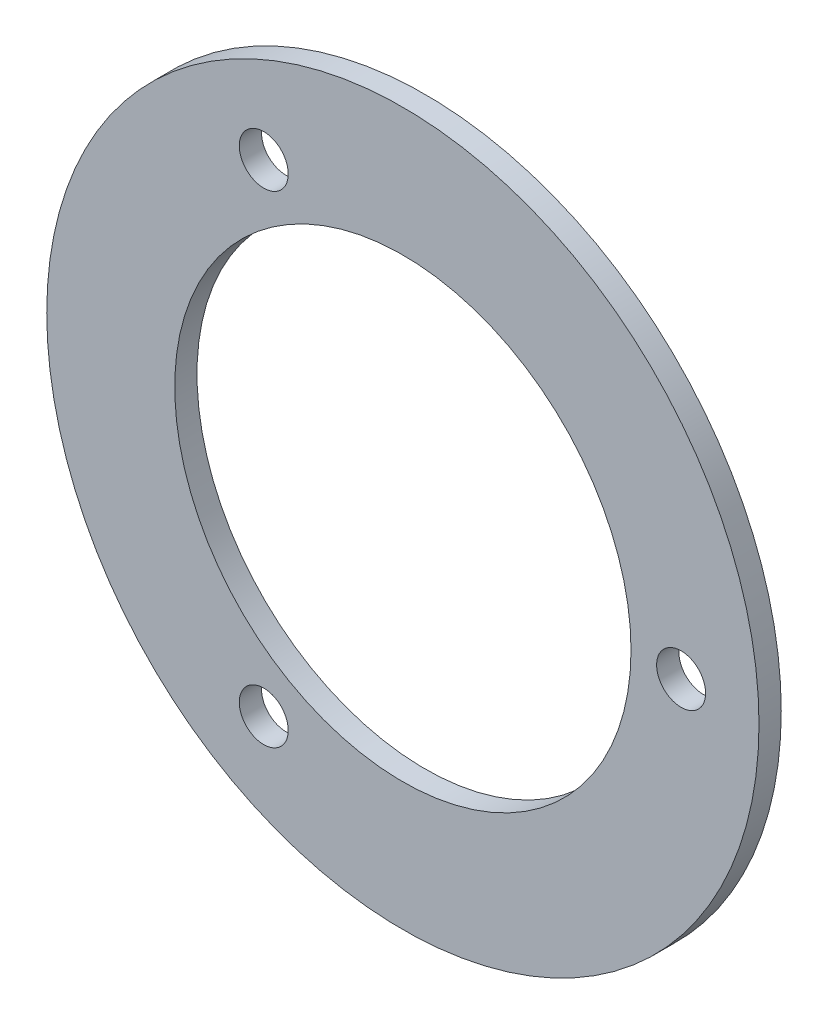
from build123d import *

# Parameters (mm, degrees)
SKETCH1_R                 = 16
SKETCH1_R_2               = 10.25
BOSS_EXTRUDE1_DEPTH       = 1
SKETCH2_R                 = 1.1
RETAINER_THREE_D2P2_DEPTH = 1.01


with BuildPart() as part:
    # Sketch1 → Boss-Extrude1 (new body)
    with BuildSketch(Plane.XY):
        Circle(SKETCH1_R)
        Circle(SKETCH1_R_2, mode=Mode.SUBTRACT)
    extrude(amount=BOSS_EXTRUDE1_DEPTH)

    # Sketch2 → Retainer_Three_D2p2 (cut)
    with BuildSketch(Plane(origin=(0, 0, 0), x_dir=(-1, 0, 0), z_dir=(0, 0, -1))):
        with Locations((-12.5, 0)):
            Circle(SKETCH2_R)
        with Locations((6.25, 10.825317547)):
            Circle(SKETCH2_R)
        with Locations((6.25, -10.825317547)):
            Circle(SKETCH2_R)
    extrude(amount=-RETAINER_THREE_D2P2_DEPTH, mode=Mode.SUBTRACT)


solid = part.part
